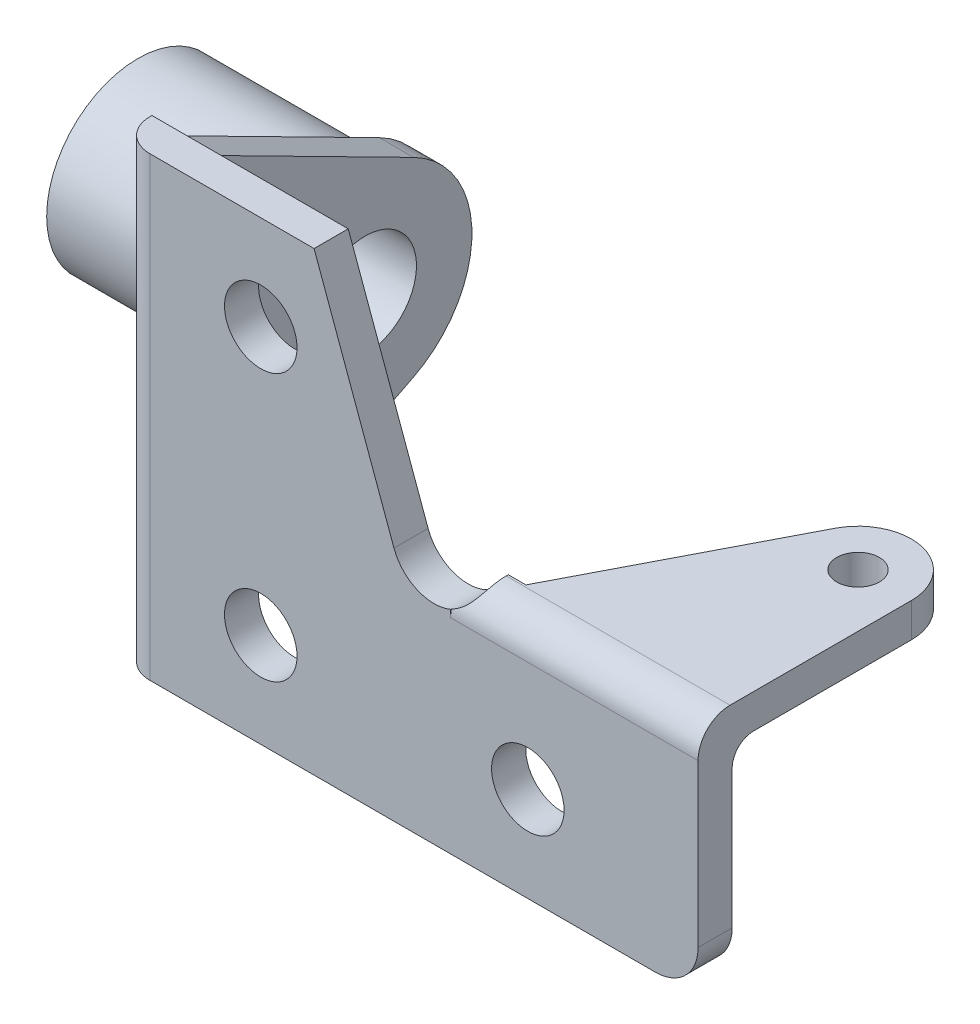
from build123d import *

# Parameters (mm, degrees)
SKETCH1_R           = 2.159
BOSS_EXTRUDE1_DEPTH = 2.032
BOSS_EXTRUDE2_DEPTH = 2.032
SKETCH3_R           = 5.4356
BOSS_EXTRUDE3_DEPTH = 11.5
SKETCH4_R           = 3.048
CUT_EXTRUDE1_DEPTH  = 57.097468274
SKETCH5_R           = 1.27
BOSS_EXTRUDE4_DEPTH = 2.032
CUT_EXTRUDE2_DEPTH  = 14.732
FILLET4_R           = 1.905
FILLET5_R           = 1.27
FILLET6_R           = 2.54


with BuildPart() as part:
    # Sketch1 → Boss-Extrude1 (new body)
    with BuildSketch(Plane.XY):
        with BuildLine():
            Line((0, 0), (0, 27.1526))
            Line((0, 27.1526), (11.684, 27.1526))
            Line((11.684, 27.1526), (16.440472212, 14.0843))
            ThreePointArc((16.440472212, 14.0843), (18.827291469, 12.413031164), (21.214110726, 14.0843))
            Line((21.214110726, 14.0843), (34.544, 14.0843))
            Line((34.544, 14.0843), (34.544, 0))
            Line((34.544, 0), (0, 0))
        make_face()
        with Locations((8.509, 21.5265)):
            Circle(SKETCH1_R, mode=Mode.SUBTRACT)
        with Locations((8.509, 5.6261)):
            Circle(SKETCH1_R, mode=Mode.SUBTRACT)
        with Locations((24.4094, 5.6261)):
            Circle(SKETCH1_R, mode=Mode.SUBTRACT)
    extrude(amount=BOSS_EXTRUDE1_DEPTH)

    # Sketch2 → Boss-Extrude2 (add)
    with BuildSketch(Plane.ZY):
        with BuildLine():
            Line((2.032, 0), (-13.544651807, 7.915259956))
            ThreePointArc((-13.544651807, 7.915259956), (-17.018, 13.5763), (-13.544651807, 19.237340044))
            Line((-13.544651807, 19.237340044), (2.032, 27.1526))
            Line((2.032, 27.1526), (2.032, 0))
        make_face()
    extrude(amount=-BOSS_EXTRUDE2_DEPTH)

    # Sketch3 → Boss-Extrude3 (add)
    with BuildSketch(Plane.ZY):
        with Locations(Location((-10.668, 13.5763, 0), (0, 0, 180))):
            Circle(SKETCH3_R)
    extrude(amount=BOSS_EXTRUDE3_DEPTH)

    # Sketch4 → Cut-Extrude1 (cut, through all)
    with BuildSketch(Plane.ZY.offset(11.5)):
        with Locations((-10.668, 13.5763)):
            Circle(SKETCH4_R)
    extrude(amount=-CUT_EXTRUDE1_DEPTH, mode=Mode.SUBTRACT)

    # Sketch5 → Boss-Extrude4 (add)
    with BuildSketch(Plane(origin=(0, 14.0843, 0), x_dir=(1, 0, 0), z_dir=(0, 1, 0))):
        with BuildLine():
            Line((21.214110726, -2.032), (28.549831644, 12.128450197))
            ThreePointArc((28.549831644, 12.128450197), (32.120586811, 13.752759677), (34.544, 10.668))
            Line((34.544, 10.668), (34.544, -2.032))
            Line((34.544, -2.032), (21.214110726, -2.032))
        make_face()
        with Locations(Location((31.369, 10.668, 0), (0, 0, 270))):
            Circle(SKETCH5_R, mode=Mode.SUBTRACT)
    extrude(amount=-BOSS_EXTRUDE4_DEPTH)

    # Sketch6 → Cut-Extrude2 (cut)
    with BuildSketch(Plane(origin=(34.544, 0, 0), x_dir=(0, 0, -1), z_dir=(1, 0, 0))):
        with BuildLine():
            Line((-0.127, 14.0843), (-2.032, 14.0843))
            Line((-2.032, 14.0843), (-2.032, 12.1793))
            ThreePointArc((-2.032, 12.1793), (-1.474038418, 13.526338418), (-0.127, 14.0843))
        make_face()
    extrude(amount=-CUT_EXTRUDE2_DEPTH, mode=Mode.SUBTRACT)

    # Fillet4
    fillet4_edges = [part.edges().sort_by_distance(p)[0] for p in [
        (0, 13.5763, 2.032),
    ]]
    fillet(fillet4_edges, radius=FILLET4_R)

    # Fillet5
    fillet5_edges = [part.edges().sort_by_distance(p)[0] for p in [
        (2.032, 13.5763, 0),
        (28.405386966, 12.0523, 0),
    ]]
    fillet(fillet5_edges, radius=FILLET5_R)

    # Fillet6
    fillet6_edges = [part.edges().sort_by_distance(p)[0] for p in [
        (34.544, 0, 1.016),
    ]]
    fillet(fillet6_edges, radius=FILLET6_R)


solid = part.part
